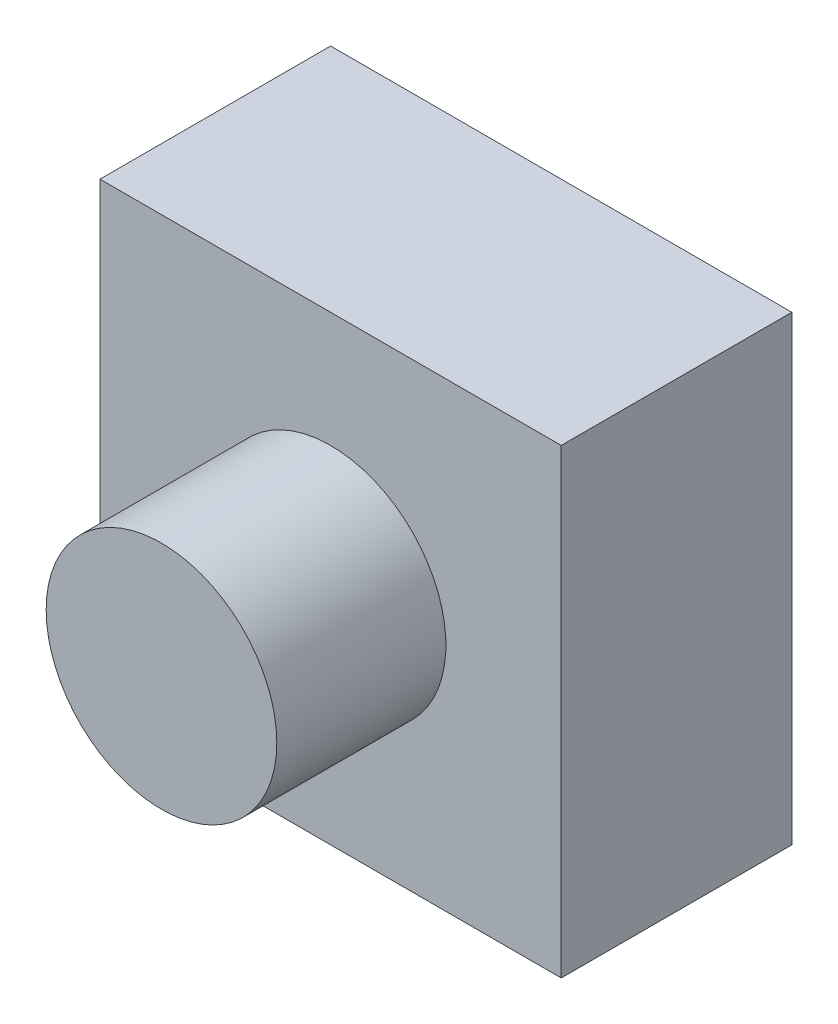
from build123d import *

# Parameters (mm, degrees)
SKETCH2_W           = 6
SKETCH2_H           = 6
BOSS_EXTRUDE1_DEPTH = 3
SKETCH3_R           = 1.5
BOSS_EXTRUDE2_DEPTH = 2.2


with BuildPart() as part:
    # Sketch2 → Boss-Extrude1 (new body)
    with BuildSketch(Plane.XY):
        Rectangle(SKETCH2_W, SKETCH2_H)
    extrude(amount=BOSS_EXTRUDE1_DEPTH)

    # Sketch3 → Boss-Extrude2 (add)
    with BuildSketch(Plane.XY.offset(3)):
        with Locations(Location((0, 0, 0), (0, 0, 180))):
            Circle(SKETCH3_R)
    extrude(amount=BOSS_EXTRUDE2_DEPTH)


solid = part.part
